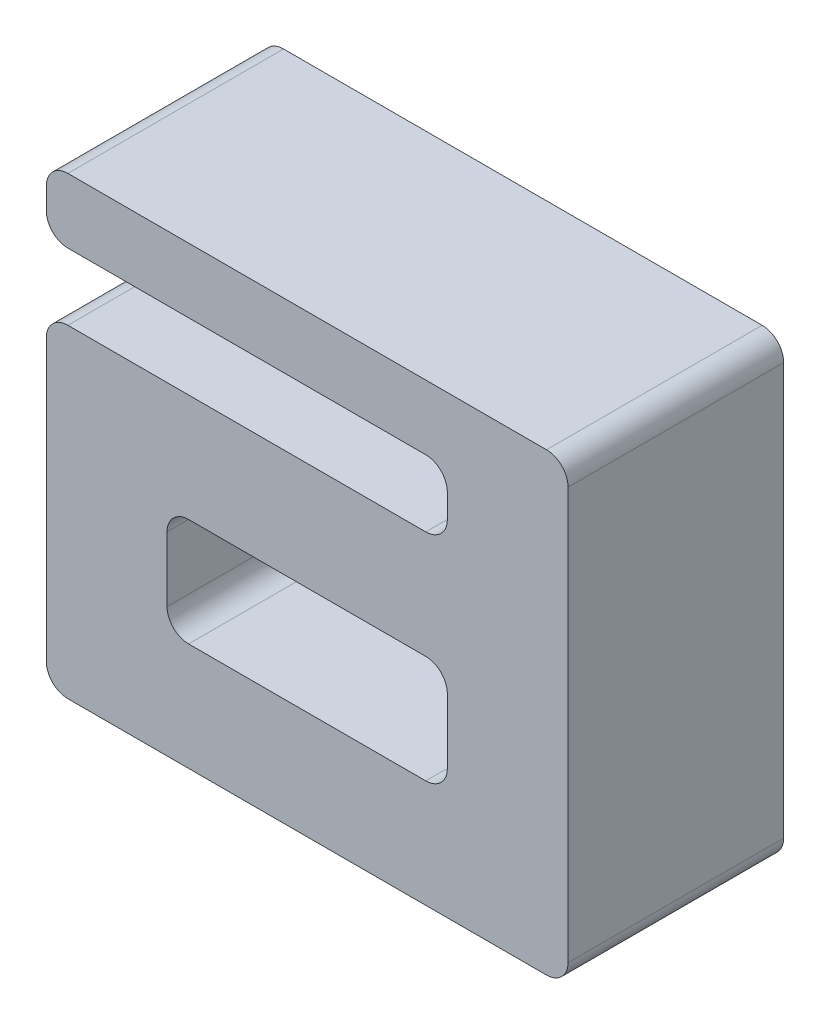
from build123d import *

# Parameters (mm, degrees)
SKETCH1_W           = 6.5
SKETCH1_H           = 2.5
BOSS_EXTRUDE1_DEPTH = 5
FILLET1_R           = 0.5


with BuildPart() as part:
    # Sketch1 → Boss-Extrude1 (new body)
    with BuildSketch(Plane.XY):
        Polygon((-6.05, -3.75), (6.05, -3.75), (6.05, 6.8), (-6.05, 6.8), (-6.05, 5.3), (3.25, 5.3), (3.25, 3.75), (-6.05, 3.75), align=None)
        Rectangle(SKETCH1_W, SKETCH1_H, mode=Mode.SUBTRACT)
    extrude(amount=BOSS_EXTRUDE1_DEPTH)

    # Fillet1
    fillet1_edges = [part.edges().sort_by_distance(p)[0] for p in [
        (-6.05, 3.75, 2.5),
        (3.25, 3.75, 2.5),
        (3.25, 5.3, 2.5),
        (-6.05, 5.3, 2.5),
        (-6.05, 6.8, 2.5),
        (6.05, 6.8, 2.5),
        (6.05, -3.75, 2.5),
        (-6.05, -3.75, 2.5),
        (-3.25, 1.25, 2.5),
        (-3.25, -1.25, 2.5),
        (3.25, -1.25, 2.5),
        (3.25, 1.25, 2.5),
    ]]
    fillet(fillet1_edges, radius=FILLET1_R)


solid = part.part
